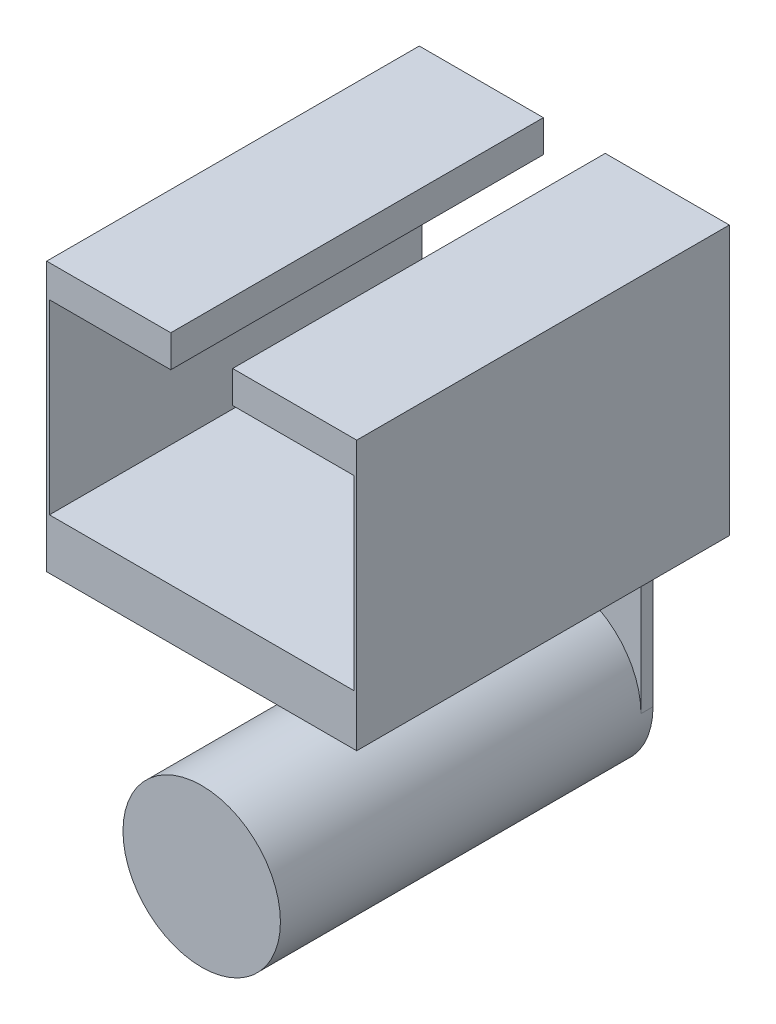
from build123d import *

# Parameters (mm, degrees)
SKETCH2_W            = 32.19958
SKETCH2_H            = 38.1
BOSS_EXTRUDE3_DEPTH  = 2.4638
SKETCH4_R            = 16.09979
BOSS_EXTRUDE4_DEPTH  = 76.2
SKETCH5_W            = 63.40856
SKETCH5_H            = 76.2
BOSS_EXTRUDE5_DEPTH  = 10.3632
SKETCH6_W            = 0.56388
SKETCH6_H            = 76.2
BOSS_EXTRUDE6_DEPTH  = 38.1
SKETCH8_W            = 0.56388
SKETCH8_H            = 76.2
BOSS_EXTRUDE7_DEPTH  = 38.1
SKETCH10_W           = 25.37968
SKETCH10_H           = 76.2
BOSS_EXTRUDE8_DEPTH  = 6.55574
SKETCH12_W           = 25.37968
SKETCH12_H           = 76.2
BOSS_EXTRUDE10_DEPTH = 6.55574


with BuildPart() as part:
    # Sketch2 → Boss-Extrude3 (new body)
    with BuildSketch(Plane.XY):
        with Locations((16.09979, 19.05)):
            Rectangle(SKETCH2_W, SKETCH2_H)
    extrude(amount=BOSS_EXTRUDE3_DEPTH)

    # Sketch4 → Boss-Extrude4 (add)
    with BuildSketch(Plane(origin=(0, 0, 0), x_dir=(-1, 0, 0), z_dir=(0, 0, -1))):
        with Locations((-16.09979, 0)):
            Circle(SKETCH4_R)
    extrude(amount=-BOSS_EXTRUDE4_DEPTH)

    # Sketch5 → Boss-Extrude5 (add)
    with BuildSketch(Plane(origin=(0, 38.1, 0), x_dir=(1, 0, 0), z_dir=(0, 1, 0))):
        with Locations((16.09979, -38.1)):
            Rectangle(SKETCH5_W, SKETCH5_H)
    extrude(amount=BOSS_EXTRUDE5_DEPTH)

    # Sketch6 → Boss-Extrude6 (add)
    with BuildSketch(Plane(origin=(0, 48.4632, 0), x_dir=(1, 0, 0), z_dir=(0, 1, 0))):
        with Locations((47.52213, -38.1)):
            Rectangle(SKETCH6_W, SKETCH6_H)
    extrude(amount=BOSS_EXTRUDE6_DEPTH)

    # Sketch8 → Boss-Extrude7 (add)
    with BuildSketch(Plane(origin=(0, 48.4632, 0), x_dir=(1, 0, 0), z_dir=(0, 1, 0))):
        with Locations((-15.32255, -38.1)):
            Rectangle(SKETCH8_W, SKETCH8_H)
    extrude(amount=BOSS_EXTRUDE7_DEPTH)

    # Sketch10 → Boss-Extrude8 (add)
    with BuildSketch(Plane(origin=(0, 86.5632, 0), x_dir=(1, 0, 0), z_dir=(0, 1, 0))):
        with Locations((-2.91465, -38.1)):
            Rectangle(SKETCH10_W, SKETCH10_H)
    extrude(amount=BOSS_EXTRUDE8_DEPTH)

    # Sketch12 → Boss-Extrude10 (add)
    with BuildSketch(Plane(origin=(0, 86.5632, 0), x_dir=(1, 0, 0), z_dir=(0, 1, 0))):
        with Locations((35.11423, -38.1)):
            Rectangle(SKETCH12_W, SKETCH12_H)
    extrude(amount=BOSS_EXTRUDE10_DEPTH)


solid = part.part
